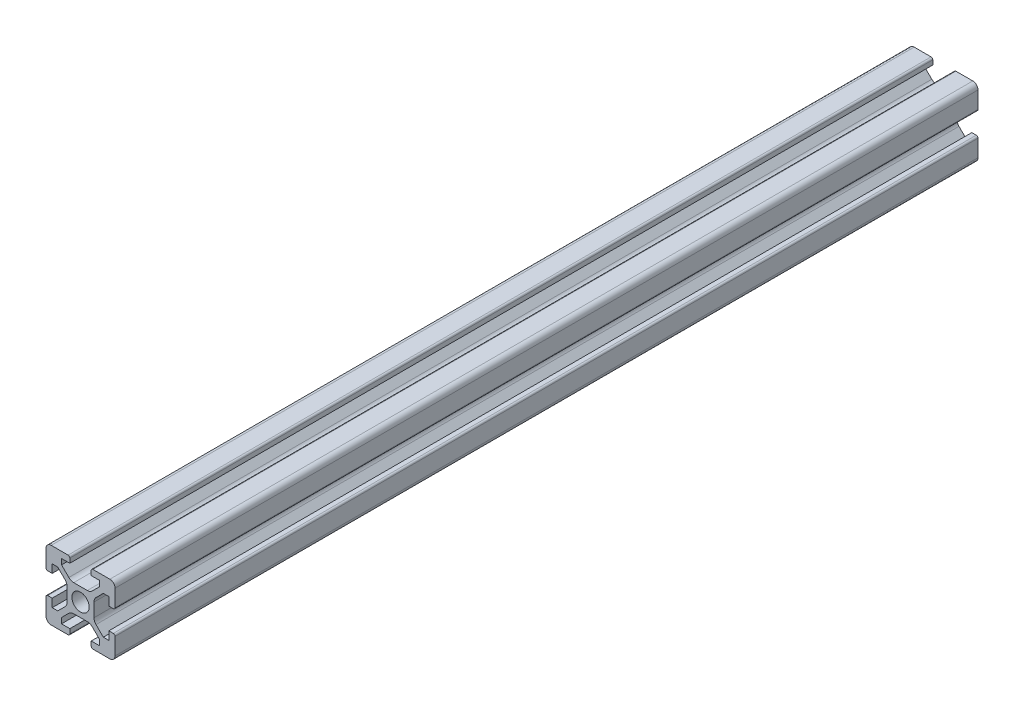
from build123d import *

# Parameters (mm, degrees)
SKETCH_1_R      = 2.5
EXTRUDE_1_DEPTH = 250


with BuildPart() as part:
    # 草图1 → 凸台-拉伸1 (new body)
    with BuildSketch(Plane.XY):
        with BuildLine():
            Line((3.9, 0), (3.9, 1.971572875))
            ThreePointArc((3.9, 1.971572875), (4.052240935, 2.73693974), (4.485786438, 3.385786438))
            Line((4.485786438, 3.385786438), (6.6, 5.5))
            Line((6.6, 5.5), (8.2, 5.5))
            Line((8.2, 5.5), (8.2, 3.1))
            Line((8.2, 3.1), (9.5, 3.1))
            ThreePointArc((9.5, 3.1), (9.853553391, 3.246446609), (10, 3.6))
            Line((10, 3.6), (10, 8.5))
            ThreePointArc((10, 8.5), (9.560660172, 9.560660172), (8.5, 10))
            Line((8.5, 10), (3.6, 10))
            ThreePointArc((3.6, 10), (3.246446609, 9.853553391), (3.1, 9.5))
            Line((3.1, 9.5), (3.1, 8.2))
            Line((3.1, 8.2), (5.5, 8.2))
            Line((5.5, 8.2), (5.5, 6.6))
            Line((5.5, 6.6), (3.385786438, 4.485786438))
            ThreePointArc((3.385786438, 4.485786438), (2.73693974, 4.052240935), (1.971572875, 3.9))
            Line((1.971572875, 3.9), (0, 3.9))
            Line((0, 3.9), (-1.971572875, 3.9))
            ThreePointArc((-1.971572875, 3.9), (-2.73693974, 4.052240935), (-3.385786438, 4.485786438))
            Line((-3.385786438, 4.485786438), (-5.5, 6.6))
            Line((-5.5, 6.6), (-5.5, 8.2))
            Line((-5.5, 8.2), (-3.1, 8.2))
            Line((-3.1, 8.2), (-3.1, 9.5))
            ThreePointArc((-3.1, 9.5), (-3.246446609, 9.853553391), (-3.6, 10))
            Line((-3.6, 10), (-8.5, 10))
            ThreePointArc((-8.5, 10), (-9.560660172, 9.560660172), (-10, 8.5))
            Line((-10, 8.5), (-10, 3.6))
            ThreePointArc((-10, 3.6), (-9.853553391, 3.246446609), (-9.5, 3.1))
            Line((-9.5, 3.1), (-8.2, 3.1))
            Line((-8.2, 3.1), (-8.2, 5.5))
            Line((-8.2, 5.5), (-6.6, 5.5))
            Line((-6.6, 5.5), (-4.485786438, 3.385786438))
            ThreePointArc((-4.485786438, 3.385786438), (-4.052240935, 2.73693974), (-3.9, 1.971572875))
            Line((-3.9, 1.971572875), (-3.9, 0))
            Line((-3.9, 0), (-3.9, -1.971572875))
            ThreePointArc((-3.9, -1.971572875), (-4.052240935, -2.73693974), (-4.485786438, -3.385786438))
            Line((-4.485786438, -3.385786438), (-6.6, -5.5))
            Line((-6.6, -5.5), (-8.2, -5.5))
            Line((-8.2, -5.5), (-8.2, -3.1))
            Line((-8.2, -3.1), (-9.5, -3.1))
            ThreePointArc((-9.5, -3.1), (-9.853553391, -3.246446609), (-10, -3.6))
            Line((-10, -3.6), (-10, -8.5))
            ThreePointArc((-10, -8.5), (-9.560660172, -9.560660172), (-8.5, -10))
            Line((-8.5, -10), (-3.6, -10))
            ThreePointArc((-3.6, -10), (-3.246446609, -9.853553391), (-3.1, -9.5))
            Line((-3.1, -9.5), (-3.1, -8.2))
            Line((-3.1, -8.2), (-5.5, -8.2))
            Line((-5.5, -8.2), (-5.5, -6.6))
            Line((-5.5, -6.6), (-3.385786438, -4.485786438))
            ThreePointArc((-3.385786438, -4.485786438), (-2.73693974, -4.052240935), (-1.971572875, -3.9))
            Line((-1.971572875, -3.9), (0, -3.9))
            Line((0, -3.9), (1.971572875, -3.9))
            ThreePointArc((1.971572875, -3.9), (2.73693974, -4.052240935), (3.385786438, -4.485786438))
            Line((3.385786438, -4.485786438), (5.5, -6.6))
            Line((5.5, -6.6), (5.5, -8.2))
            Line((5.5, -8.2), (3.1, -8.2))
            Line((3.1, -8.2), (3.1, -9.5))
            ThreePointArc((3.1, -9.5), (3.246446609, -9.853553391), (3.6, -10))
            Line((3.6, -10), (8.5, -10))
            ThreePointArc((8.5, -10), (9.560660172, -9.560660172), (10, -8.5))
            Line((10, -8.5), (10, -3.6))
            ThreePointArc((10, -3.6), (9.853553391, -3.246446609), (9.5, -3.1))
            Line((9.5, -3.1), (8.2, -3.1))
            Line((8.2, -3.1), (8.2, -5.5))
            Line((8.2, -5.5), (6.6, -5.5))
            Line((6.6, -5.5), (4.485786438, -3.385786438))
            ThreePointArc((4.485786438, -3.385786438), (4.052240935, -2.73693974), (3.9, -1.971572875))
            Line((3.9, -1.971572875), (3.9, 0))
        make_face()
        Circle(SKETCH_1_R, mode=Mode.SUBTRACT)
    extrude(amount=EXTRUDE_1_DEPTH)


solid = part.part
